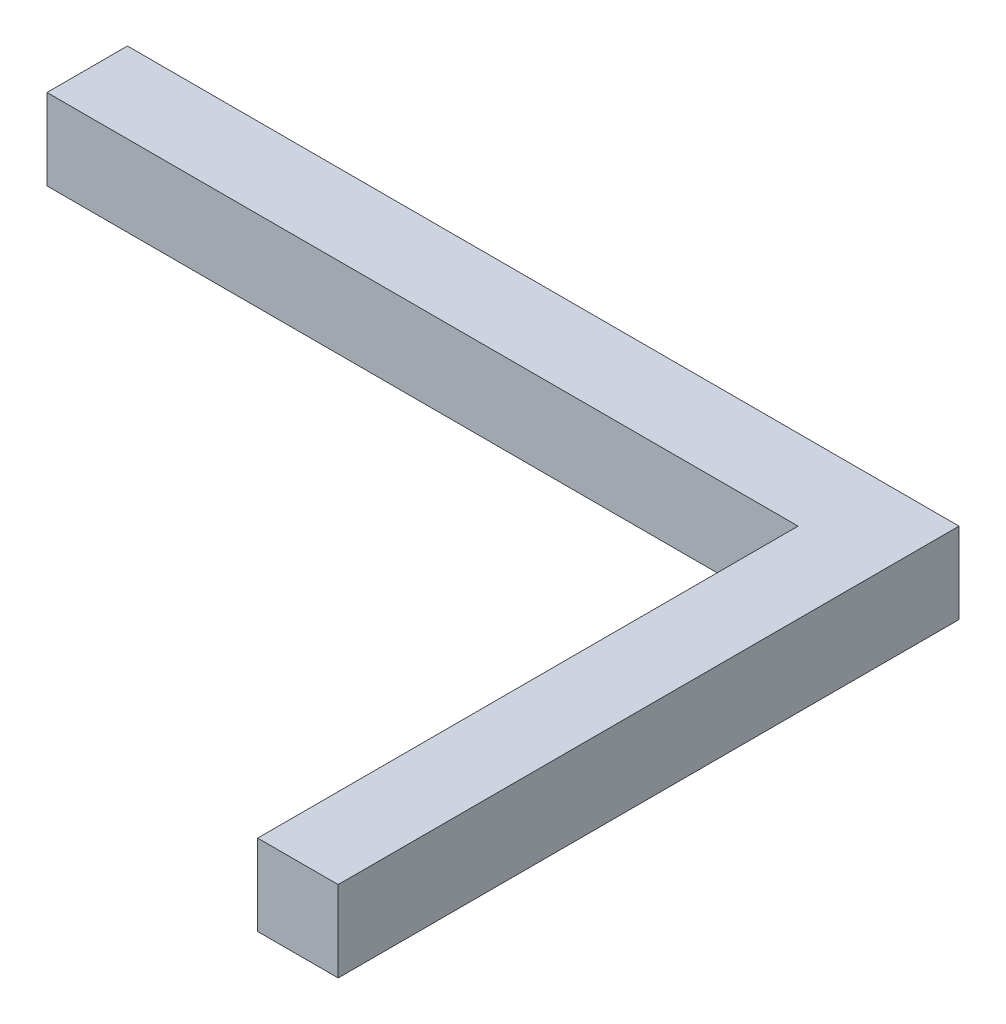
from build123d import *

# Parameters (mm, degrees)
SKETCH1_W           = 49.600000114
SKETCH1_H           = 49.600000114
BOSS_EXTRUDE1_DEPTH = 4.826
SKETCH2_W           = 44.800000062
SKETCH2_H           = 44.800000062
CUT_EXTRUDE1_DEPTH  = 71.310812103
SKETCH6_W           = 12.570000133
SKETCH6_H           = 4.826
CUT_EXTRUDE2_DEPTH  = 71.310812103


with BuildPart() as part:
    # Sketch1 → Boss-Extrude1 (new body)
    with BuildSketch(Plane(origin=(0, 0, 0), x_dir=(1, 0, 0), z_dir=(0, 1, 0))):
        with Locations((24.800000057, 24.800000057)):
            Rectangle(SKETCH1_W, SKETCH1_H)
    extrude(amount=BOSS_EXTRUDE1_DEPTH)

    # Sketch2 → Cut-Extrude1 (cut, through all)
    with BuildSketch(Plane(origin=(0, 4.826, 0), x_dir=(1, 0, 0), z_dir=(0, 1, 0))):
        with Locations((22.400000031, 22.400000031)):
            Rectangle(SKETCH2_W, SKETCH2_H)
    extrude(amount=-CUT_EXTRUDE1_DEPTH, mode=Mode.SUBTRACT)

    # Sketch6 → Cut-Extrude2 (cut, through all)
    with BuildSketch(Plane(origin=(49.600000114, 0, 0), x_dir=(0, 0, -1), z_dir=(1, 0, 0))):
        with Locations((6.285000067, 2.413)):
            Rectangle(SKETCH6_W, SKETCH6_H)
    extrude(amount=-CUT_EXTRUDE2_DEPTH, mode=Mode.SUBTRACT)


solid = part.part
